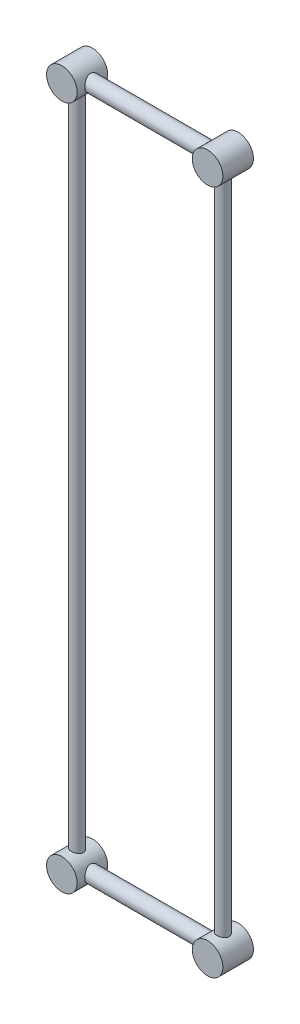
from build123d import *

# Parameters (mm, degrees)
SKETCH1_R                = 5
BOSS_EXTRUDE1_DEPTH      = 80
BOSS_EXTRUDE2_DEPTH      = 10
BOSS_EXTRUDE2_DEPTH_BACK = 10
SKETCH2_R                = 10
SKETCH3_R                = 3.98820793
BOSS_EXTRUDE3_DEPTH      = 448


with BuildPart() as part:
    # Sketch1 → Boss-Extrude1 (new body)
    with BuildSketch(Plane(origin=(0, 0, 0), x_dir=(0, 0, -1), z_dir=(1, 0, 0))):
        Circle(SKETCH1_R)
    extrude(amount=BOSS_EXTRUDE1_DEPTH)


with BuildPart() as body_2:
    # Sketch2 → Boss-Extrude2 (new, two sides: drawn at the far end of the back side and taken through both)
    with BuildSketch(Plane.XY.offset(-BOSS_EXTRUDE2_DEPTH_BACK)):
        with Locations((-7.666034923, 0)):
            Circle(SKETCH2_R)
    extrude(amount=BOSS_EXTRUDE2_DEPTH + BOSS_EXTRUDE2_DEPTH_BACK)

    # Sketch3 → Boss-Extrude3 (add)
    with BuildSketch(Plane(origin=(0, 0, 0), x_dir=(1, 0, 0), z_dir=(0, 1, 0))):
        with Locations((-7.666034923, 0)):
            Circle(SKETCH3_R)
    extrude(amount=-BOSS_EXTRUDE3_DEPTH)


with BuildPart() as body_3:
    # Mirror1: mirrored copy
    add(part.part.mirror(Plane.ZX.offset(-224)))


with BuildPart() as body_4:
    # Mirror1 2: mirrored copy
    add(body_2.part.mirror(Plane.ZX.offset(-224)))


with BuildPart() as body_5:
    # Mirror2: mirrored copy
    add(part.part.mirror(Plane.ZY.offset(-40)))


with BuildPart() as body_6:
    # Mirror2 2: mirrored copy
    add(body_3.part.mirror(Plane.ZY.offset(-40)))


with BuildPart() as body_7:
    # Mirror2 3: mirrored copy
    add(body_4.part.mirror(Plane.ZY.offset(-40)))


with BuildPart() as body_8:
    # Mirror2 4: mirrored copy
    add(body_2.part.mirror(Plane.ZY.offset(-40)))


with BuildPart() as body_7_1:
    add(body_7.part)

    # Combine1: union part, body 8, body 5, body 2, body 3, body 6, body 4
    add(part.part)
    add(body_8.part)
    add(body_5.part)
    add(body_2.part)
    add(body_3.part)
    add(body_6.part)
    add(body_4.part)


solid = body_7_1.part
